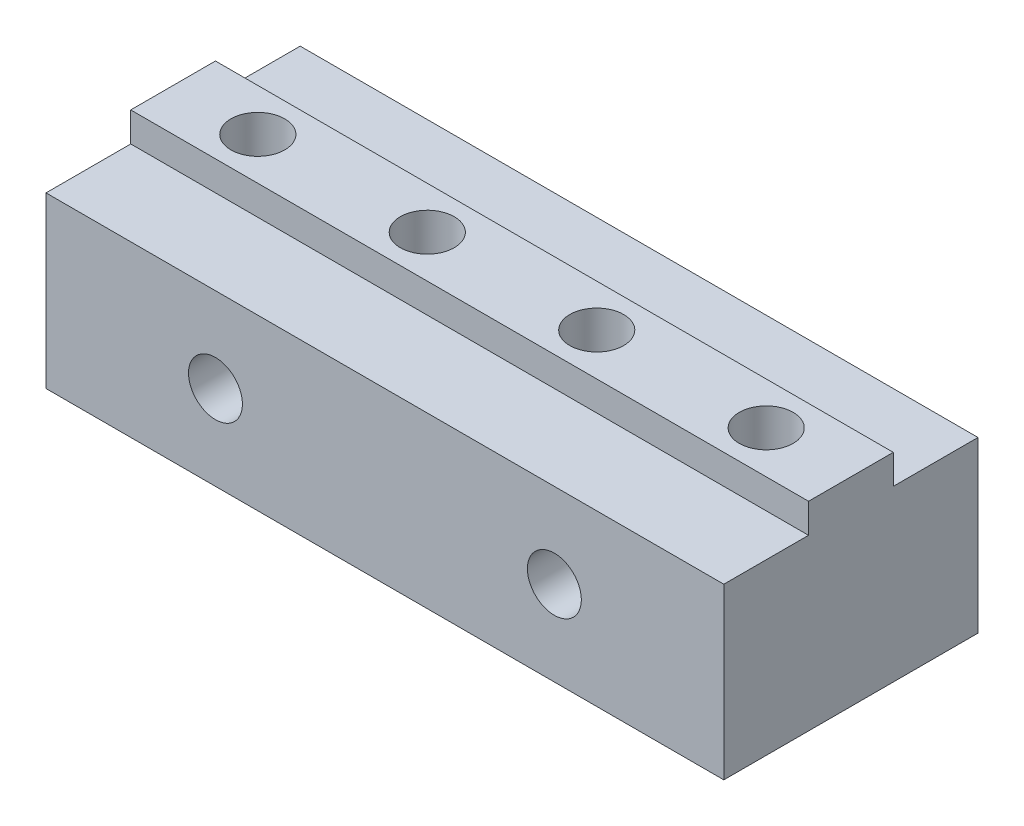
from build123d import *

# Parameters (mm, degrees)
SKETCH1_W              = 50.8
SKETCH1_H              = 19.05
BOSS_EXTRUDE1_DEPTH    = 12.7
SKETCH2_W              = 50.8
SKETCH2_H              = 6.35
BOSS_EXTRUDE2_DEPTH    = 2.2098
F_10_32_TAPPED_HOLE1_D = 4.0386
F_10_32_TAPPED_HOLE2_D = 4.0386


with BuildPart() as part:
    # Sketch1 → Boss-Extrude1 (new body)
    with BuildSketch(Plane(origin=(0, 0, 0), x_dir=(1, 0, 0), z_dir=(0, 1, 0))):
        Rectangle(SKETCH1_W, SKETCH1_H)
    extrude(amount=BOSS_EXTRUDE1_DEPTH)

    # Sketch2 → Boss-Extrude2 (add)
    with BuildSketch(Plane(origin=(0, 12.7, 0), x_dir=(1, 0, 0), z_dir=(0, 1, 0))):
        Rectangle(SKETCH2_W, SKETCH2_H)
    extrude(amount=BOSS_EXTRUDE2_DEPTH)

    # #10-32 Tapped Hole1 (through all)
    with Locations(Plane(origin=(0, 0, -9.525), x_dir=(-1, 0, 0), z_dir=(0, 0, -1))):
        with Locations((12.7, 6.35), (-12.7, 6.35)):
            Hole(F_10_32_TAPPED_HOLE1_D / 2)

    # #10-32 Tapped Hole2 (through all)
    with Locations(Plane(origin=(0, 0, 0), x_dir=(-1, 0, 0), z_dir=(0, -1, 0))):
        with Locations((-19.05, 0), (19.05, 0), (6.35, 0), (-6.35, 0)):
            Hole(F_10_32_TAPPED_HOLE2_D / 2)


solid = part.part
